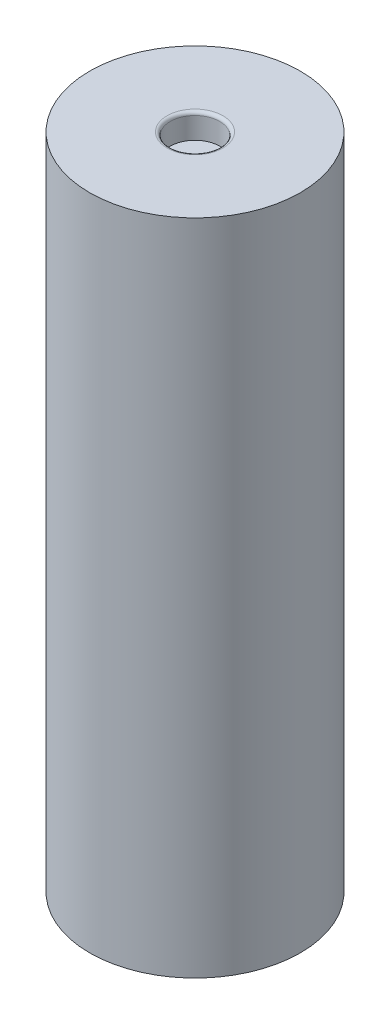
from build123d import *

# Parameters (mm, degrees)
SKETCH1_R           = 6.4
BOSS_EXTRUDE1_DEPTH = 40
SKETCH2_R           = 1.5
CUT_EXTRUDE1_DEPTH  = 1.5
FILLET2_R           = 0.2


with BuildPart() as part:
    # Sketch1 → Boss-Extrude1 (new body)
    with BuildSketch(Plane(origin=(0, 0, 0), x_dir=(1, 0, 0), z_dir=(0, 1, 0))):
        with Locations(Location((0, 0, 0), (0, 0, 270))):
            Circle(SKETCH1_R)
    extrude(amount=BOSS_EXTRUDE1_DEPTH)

    # Sketch2 → Cut-Extrude1 (cut)
    with BuildSketch(Plane(origin=(0, 40, 0), x_dir=(1, 0, 0), z_dir=(0, 1, 0))):
        with Locations(Location((0, 0, 0), (0, 0, 270))):
            Circle(SKETCH2_R)
    cut_extrude1 = extrude(amount=-CUT_EXTRUDE1_DEPTH, mode=Mode.SUBTRACT)

    # Mirror1: Cut-Extrude1 across plane
    add(cut_extrude1.mirror(Plane.ZX.offset(20)), mode=Mode.SUBTRACT)

    # Fillet2
    fillet2_edges = [part.edges().sort_by_distance(p)[0] for p in [
        (0, 0, -1.5),
        (0, 40, -1.5),
    ]]
    fillet(fillet2_edges, radius=FILLET2_R)


solid = part.part
